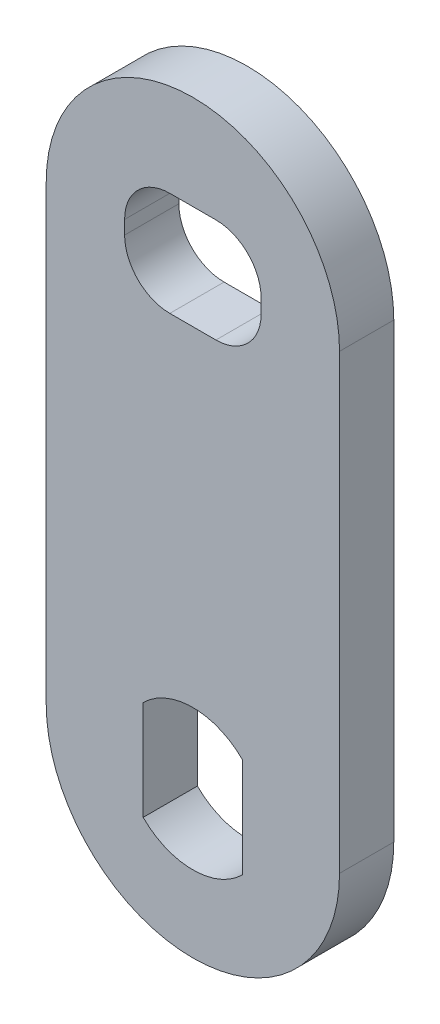
from build123d import *

# Parameters (mm, degrees)
SKETCH1_W           = 7.55
SKETCH1_H           = 5.75
BOSS_EXTRUDE1_DEPTH = 3
FILLET1_R           = 2.5
CUT_EXTRUDE1_DEPTH  = 3


with BuildPart() as part:
    # Sketch1 → Boss-Extrude1 (new body)
    with BuildSketch(Plane.XY):
        with BuildLine():
            Line((-8.11, 12.5), (-8.11, -12.5))
            ThreePointArc((-8.11, -12.5), (0, -20.61), (8.11, -12.5))
            Line((8.11, -12.5), (8.11, 12.5))
            ThreePointArc((8.11, 12.5), (0, 20.61), (-8.11, 12.5))
        make_face()
        with Locations((0, 12.5)):
            Rectangle(SKETCH1_W, SKETCH1_H, mode=Mode.SUBTRACT)
    extrude(amount=BOSS_EXTRUDE1_DEPTH)

    # Fillet1
    fillet1_edges = [part.edges().sort_by_distance(p)[0] for p in [
        (3.775, 9.625, 1.5),
        (3.775, 15.375, 1.5),
        (-3.775, 15.375, 1.5),
        (-3.775, 9.625, 1.5),
    ]]
    fillet(fillet1_edges, radius=FILLET1_R)

    # Sketch2 → Cut-Extrude1 (cut)
    with BuildSketch(Plane.XY.offset(3)):
        with BuildLine():
            Line((-2.75, -9.75), (-2.75, -15.25))
            ThreePointArc((-2.75, -15.25), (0, -16.389087297), (2.75, -15.25))
            Line((2.75, -15.25), (2.75, -9.75))
            ThreePointArc((2.75, -9.75), (0, -8.610912703), (-2.75, -9.75))
        make_face()
    extrude(amount=-CUT_EXTRUDE1_DEPTH, mode=Mode.SUBTRACT)


solid = part.part
